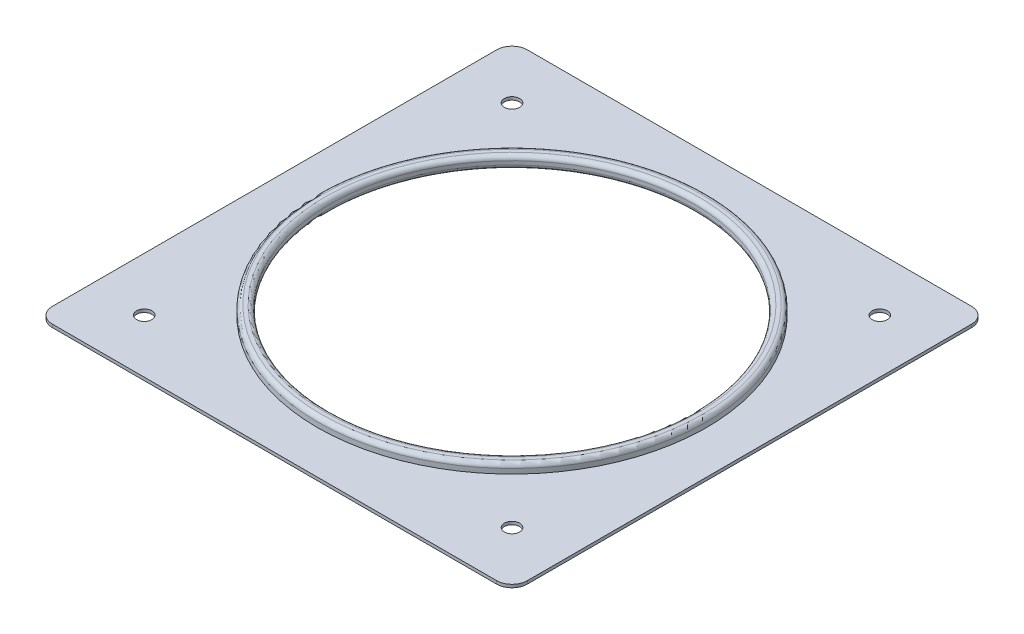
from build123d import *

# Parameters (mm, degrees)
SKETCH1_R           = 59.5
SKETCH1_R_2         = 2.5
BOSS_EXTRUDE1_DEPTH = 1
SKETCH2_R           = 63.5
SKETCH2_R_2         = 59.5
BOSS_EXTRUDE2_DEPTH = 3
FILLET1_R           = 1.4
FILLET2_R           = 1.4


with BuildPart() as part:
    # Sketch1 → Boss-Extrude1 (new body)
    with BuildSketch(Plane(origin=(0, 0, 0), x_dir=(1, 0, 0), z_dir=(0, 1, 0))):
        with BuildLine():
            Line((-72.5, -77.5), (72.5, -77.5))
            ThreePointArc((72.5, -77.5), (76.035533906, -76.035533906), (77.5, -72.5))
            Line((77.5, -72.5), (77.5, 72.5))
            ThreePointArc((77.5, 72.5), (76.035533906, 76.035533906), (72.5, 77.5))
            Line((72.5, 77.5), (-72.5, 77.5))
            ThreePointArc((-72.5, 77.5), (-76.035533906, 76.035533906), (-77.5, 72.5))
            Line((-77.5, 72.5), (-77.5, -72.5))
            ThreePointArc((-77.5, -72.5), (-76.035533906, -76.035533906), (-72.5, -77.5))
        make_face()
        with Locations(Location((0, 0, 0), (0, 0, 270))):
            Circle(SKETCH1_R, mode=Mode.SUBTRACT)
        with Locations(Location((-60, 60, 0), (0, 0, 270))):
            Circle(SKETCH1_R_2, mode=Mode.SUBTRACT)
        with Locations(Location((60, 60, 0), (0, 0, 270))):
            Circle(SKETCH1_R_2, mode=Mode.SUBTRACT)
        with Locations(Location((60, -60, 0), (0, 0, 270))):
            Circle(SKETCH1_R_2, mode=Mode.SUBTRACT)
        with Locations(Location((-60, -60, 0), (0, 0, 270))):
            Circle(SKETCH1_R_2, mode=Mode.SUBTRACT)
    extrude(amount=BOSS_EXTRUDE1_DEPTH)

    # Sketch2 → Boss-Extrude2 (add)
    with BuildSketch(Plane(origin=(0, 1, 0), x_dir=(1, 0, 0), z_dir=(0, 1, 0))):
        with Locations(Location((0, 0, 0), (0, 0, 270))):
            Circle(SKETCH2_R)
        with Locations(Location((0, 0, 0), (0, 0, 270))):
            Circle(SKETCH2_R_2, mode=Mode.SUBTRACT)
    extrude(amount=BOSS_EXTRUDE2_DEPTH)

    # Fillet1
    fillet1_edges = [part.edges().sort_by_distance(p)[0] for p in [
        (0, 4, -63.5),
        (0, 4, -59.5),
    ]]
    fillet(fillet1_edges, radius=FILLET1_R)

    # Fillet2
    fillet2_edges = [part.edges().sort_by_distance(p)[0] for p in [
        (0, 0, -59.5),
    ]]
    fillet(fillet2_edges, radius=FILLET2_R)


solid = part.part
